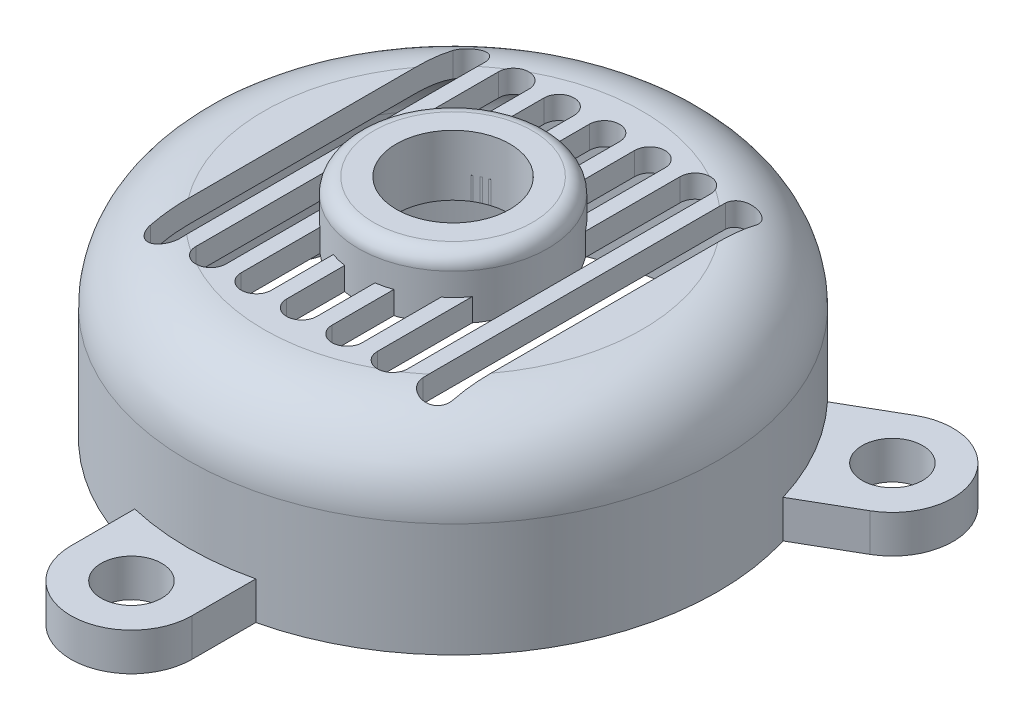
from build123d import *

# Parameters (mm, degrees)
SKETCH1_R                = 35
BOSS_EXTRUDE1_DEPTH      = 25
FILLET1_R                = 10
SHELL1_T                 = -3
SKETCH2_R                = 4
BOSS_EXTRUDE2_DEPTH      = 5
CIRPATTERN1_COUNT        = 3
CUT_EXTRUDE1_DEPTH       = 72.991907702
LPATTERN1_COUNT          = 7
LPATTERN1_PITCH          = 6
BOSS_EXTRUDE3_DEPTH      = 5
BOSS_EXTRUDE3_DEPTH_BACK = 3
SKETCH6_R                = 12.5
FILLET2_R                = 2
SKETCH7_R                = 7.5
CUT_EXTRUDE2_DEPTH       = 74.877160033


with BuildPart() as part:
    # Sketch1 → Boss-Extrude1 (new body)
    with BuildSketch(Plane(origin=(0, 0, 0), x_dir=(1, 0, 0), z_dir=(0, 1, 0))):
        with Locations(Location((0, 0, 0), (0, 0, 270))):
            Circle(SKETCH1_R)
    extrude(amount=BOSS_EXTRUDE1_DEPTH)

    # Fillet1
    fillet1_edges = [part.edges().sort_by_distance(p)[0] for p in [
        (0, 25, -35),
    ]]
    fillet(fillet1_edges, radius=FILLET1_R)

    # Shell1
    shell1_openings = [part.faces().sort_by_distance(p)[0] for p in [
        (0, 0, 0),
    ]]
    offset(amount=SHELL1_T, openings=shell1_openings, kind=Kind.INTERSECTION)

    # Sketch2 → Boss-Extrude2 (add)
    with BuildSketch(Plane.XZ):
        with BuildLine():
            Line((-8, 42.5), (-8, 32))
            Line((-8, 32), (8, 32))
            Line((8, 32), (8, 42.5))
            ThreePointArc((8, 42.5), (0, 50.5), (-8, 42.5))
        make_face()
        with Locations(Location((0, 42.5, 0), (0, 0, 270))):
            Circle(SKETCH2_R, mode=Mode.SUBTRACT)
    boss_extrude2 = extrude(amount=-BOSS_EXTRUDE2_DEPTH)

    # CirPattern1: Boss-Extrude2 ×3 about axis
    cirpattern1_axis = Axis((0, 0, 0), (0, 1, 0))
    for i in range(1, CIRPATTERN1_COUNT):
        add(boss_extrude2.rotate(cirpattern1_axis, i * 360 / CIRPATTERN1_COUNT))

    # Sketch3 → Cut-Extrude1 (cut, through all)
    with BuildSketch(Plane(origin=(0, 25, 0), x_dir=(1, 0, 0), z_dir=(0, 1, 0))):
        with BuildLine():
            Line((-16, 20), (-16, -20))
            ThreePointArc((-16, -20), (-18, -22), (-20, -20))
            Line((-20, -20), (-20, 20))
            ThreePointArc((-20, 20), (-18, 22), (-16, 20))
        make_face()
    cut_extrude1 = extrude(amount=-CUT_EXTRUDE1_DEPTH, mode=Mode.SUBTRACT)

    # LPattern1: Cut-Extrude1 ×7
    with Locations(*[(i * LPATTERN1_PITCH, 0, 0) for i in range(1, LPATTERN1_COUNT)]):
        add(cut_extrude1, mode=Mode.SUBTRACT)


with BuildPart() as body_2:
    # Sketch6 → Boss-Extrude3 (new, two sides: drawn at the far end of the back side and taken through both)
    with BuildSketch(Plane(origin=(0, 25, 0), x_dir=(1, 0, 0), z_dir=(0, 1, 0)).offset(-BOSS_EXTRUDE3_DEPTH_BACK)):
        with Locations(Location((0, 0, 0), (0, 0, 270))):
            Circle(SKETCH6_R)
    extrude(amount=BOSS_EXTRUDE3_DEPTH + BOSS_EXTRUDE3_DEPTH_BACK)

    # Fillet2
    fillet2_edges = [body_2.edges().sort_by_distance(p)[0] for p in [
        (0, 30, -12.5),
    ]]
    fillet(fillet2_edges, radius=FILLET2_R)


with BuildPart() as cut_extrude2_tool:
    # Sketch7 → Cut-Extrude2 (new, through all)
    with BuildSketch(Plane(origin=(0, 30, 0), x_dir=(1, 0, 0), z_dir=(0, 1, 0))):
        with Locations(Location((0, 0, 0), (0, 0, 270))):
            Circle(SKETCH7_R)
    extrude(amount=-CUT_EXTRUDE2_DEPTH)


with BuildPart() as part_1:
    add(part.part)

    # Cut-Extrude2: cut by cut_extrude2_tool
    add(cut_extrude2_tool.part, mode=Mode.SUBTRACT)


with BuildPart() as body_2_1:
    add(body_2.part)

    # Cut-Extrude2: cut by cut_extrude2_tool
    add(cut_extrude2_tool.part, mode=Mode.SUBTRACT)


solid = Compound([part_1.part, body_2_1.part])
